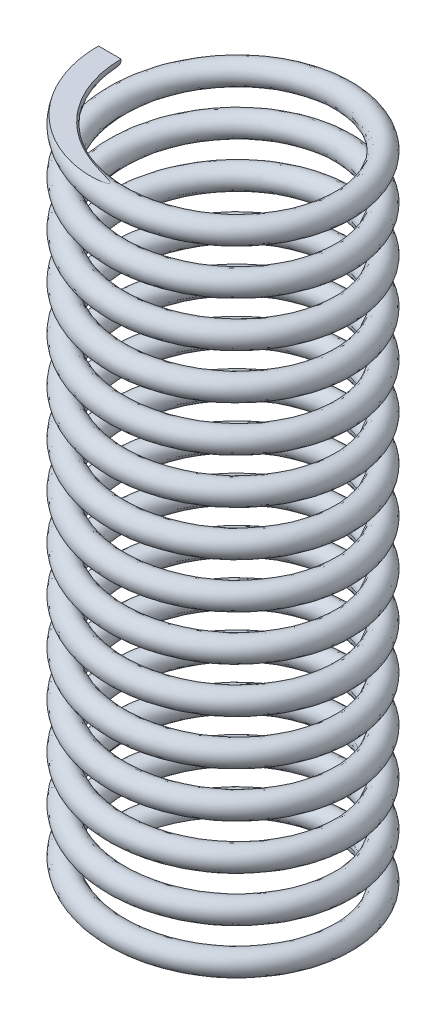
from build123d import *

# Parameters (mm, degrees)
SWEEP_1_PITCH            = 2
SWEEP_1_HEIGHT           = 30
SWEEP_1_RADIUS           = 5
SWEEP_1_START_ANGLE      = -90
SKETCH_2_R               = 0.5
CUT_EXTRUDE_1_DEPTH      = 10
CUT_EXTRUDE_1_DEPTH_BACK = 10


with BuildPart() as part:
    # 扫描1: sweep along a helix
    with BuildLine() as sweep_1_path:
        add(Helix(SWEEP_1_PITCH, SWEEP_1_HEIGHT, SWEEP_1_RADIUS, center=(0, 0, 0), direction=(0, 1, 0), lefthand=True, mode=Mode.PRIVATE).rotate(Axis((0, 0, 0), (0, 1, 0)), SWEEP_1_START_ANGLE))
    # 草图2 → 扫描1 (sweep)
    with BuildSketch(Plane.XY):
        with Locations((-5, 0)):
            Circle(SKETCH_2_R)
    sweep(path=sweep_1_path.line, is_frenet=True)

    # 草图3 → 切除-拉伸1 (cut, two sides: drawn at the far end of the back side and taken through both)
    with BuildSketch(Plane.XY.offset(-CUT_EXTRUDE_1_DEPTH_BACK)):
        Polygon((9.914358936, 30), (0, 30), (-8.810873467, 30), (-4.572358861, 31.253277664), align=None)
        Polygon((-8.01381653, 0), (0, 0), (7.430832977, 0), (-8.01381653, -1.431638244), align=None)
    extrude(amount=CUT_EXTRUDE_1_DEPTH + CUT_EXTRUDE_1_DEPTH_BACK, mode=Mode.SUBTRACT)


solid = part.part
